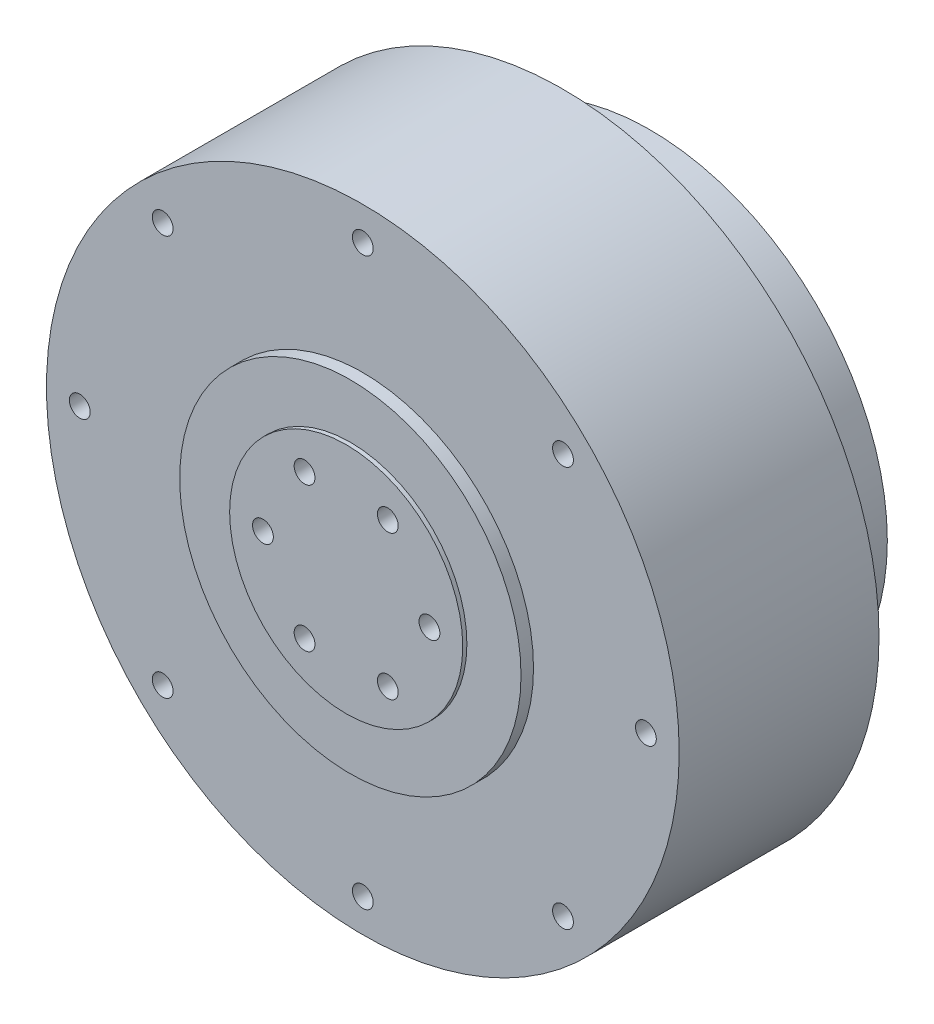
from build123d import *

# Parameters (mm, degrees)
M3_TAPPED_HOLE3_D     = 2.5
M3_TAPPED_HOLE3_DEPTH = 7.5
M3_TAPPED_HOLE3_TIP   = 0.751075774
M3_TAPPED_HOLE1_D     = 2.5
M3_TAPPED_HOLE1_DEPTH = 3
M3_TAPPED_HOLE1_TIP   = 0.751075774
M3_TAPPED_HOLE2_D     = 2.5
M3_TAPPED_HOLE2_DEPTH = 3
M3_TAPPED_HOLE2_TIP   = 0.751075774


with BuildPart() as part:
    # Sketch1 → Revolve1 (revolve)
    with BuildSketch(Plane(origin=(0, 0, 0), x_dir=(0, 0, -1), z_dir=(1, 0, 0)), mode=Mode.PRIVATE) as revolve1_sk:
        Polygon((0, 0), (0, 14), (0.5, 14), (0.5, 20.5), (2, 20.5), (2, 38), (26, 38), (26, 28.5), (36.5, 28.5), (36.5, 0), align=None)
    revolve(revolve1_sk.sketch.rotate(Axis((0, 0, 42.770748728), (0, 0, -1)), 90), axis=Axis((0, 0, 42.770748728), (0, 0, -1)))

    # M3 Tapped Hole3
    with Locations(Plane.XY):
        with Locations((-10, 0), (-5, 8.660254038), (5, 8.660254038), (10, 0), (5, -8.660254038), (-5, -8.660254038)):
            Hole(M3_TAPPED_HOLE3_D / 2, depth=M3_TAPPED_HOLE3_DEPTH)
            with Locations((0, 0, -(M3_TAPPED_HOLE3_DEPTH + M3_TAPPED_HOLE3_TIP / 2))):  # 118° drill point
                Cone(0, M3_TAPPED_HOLE3_D / 2, M3_TAPPED_HOLE3_TIP, mode=Mode.SUBTRACT)

    # M3 Tapped Hole1
    with Locations(Plane.XY.offset(-2)):
        with Locations((-34, 0), (-24.04163056, 24.04163056), (0, 34), (24.04163056, 24.04163056), (34, 0), (24.04163056, -24.04163056), (0, -34), (-24.04163056, -24.04163056)):
            Hole(M3_TAPPED_HOLE1_D / 2, depth=M3_TAPPED_HOLE1_DEPTH)
            with Locations((0, 0, -(M3_TAPPED_HOLE1_DEPTH + M3_TAPPED_HOLE1_TIP / 2))):  # 118° drill point
                Cone(0, M3_TAPPED_HOLE1_D / 2, M3_TAPPED_HOLE1_TIP, mode=Mode.SUBTRACT)

    # M3 Tapped Hole2
    with Locations(Plane(origin=(0, 0, -26), x_dir=(-1, 0, 0), z_dir=(0, 0, -1))):
        with Locations((-34, 0), (-24.04163056, 24.04163056), (0, 34), (24.04163056, 24.04163056), (34, 0), (24.04163056, -24.04163056), (0, -34), (-24.04163056, -24.04163056)):
            Hole(M3_TAPPED_HOLE2_D / 2, depth=M3_TAPPED_HOLE2_DEPTH)
            with Locations((0, 0, -(M3_TAPPED_HOLE2_DEPTH + M3_TAPPED_HOLE2_TIP / 2))):  # 118° drill point
                Cone(0, M3_TAPPED_HOLE2_D / 2, M3_TAPPED_HOLE2_TIP, mode=Mode.SUBTRACT)


solid = part.part
